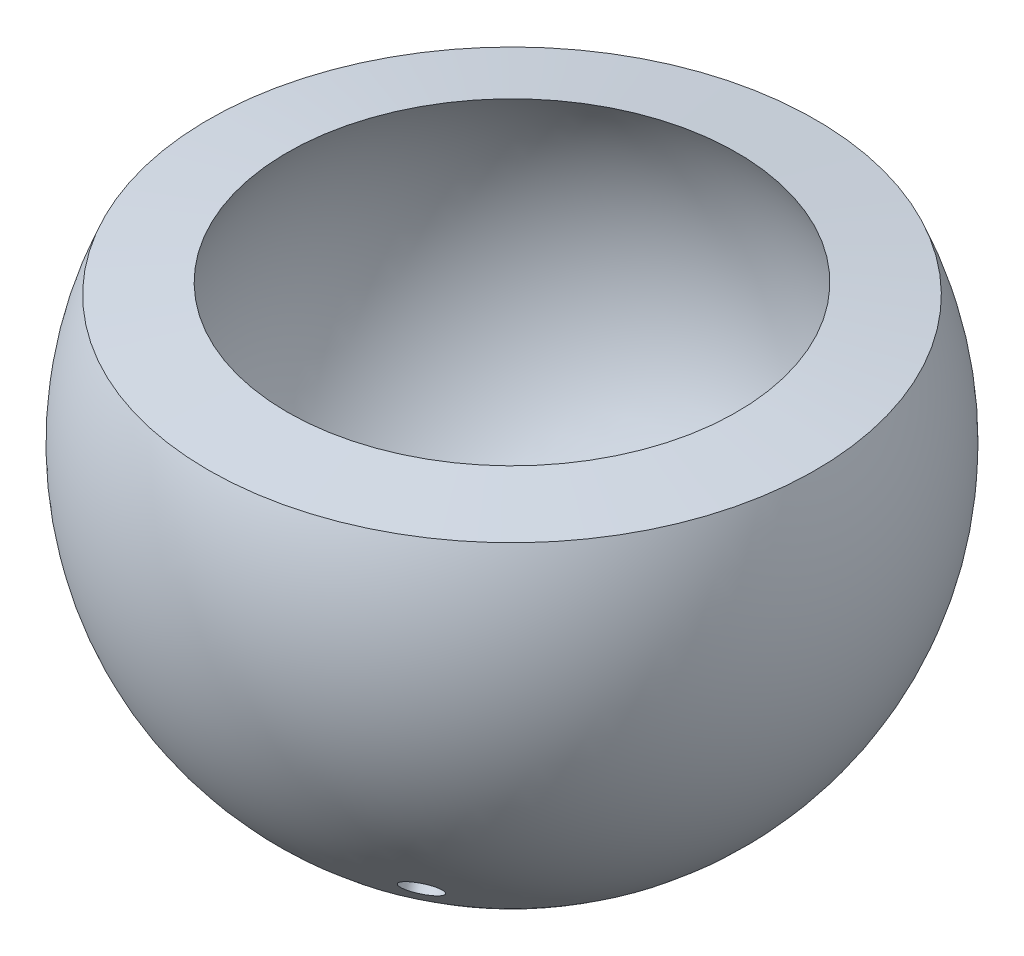
from build123d import *

# Parameters (mm, degrees)
F_7_0_201_DIAMETER_HOLE1_D     = 5.1054
F_7_0_201_DIAMETER_HOLE1_DEPTH = 101.176865362
CIRPATTERN1_COUNT              = 3
SKETCH7_R                      = 2.54
CUT_EXTRUDE1_DEPTH             = 84.368801521


with BuildPart() as part:
    # Sketch1 one side → Revolve1 (revolve)
    with BuildSketch(Plane.XY, mode=Mode.PRIVATE) as revolve1_sk:
        with BuildLine():
            ThreePointArc((0, -38.608), (-33.727527511, -18.789133881), (-32.827964664, 20.32))
            Line((-32.827964664, 20.32), (-44.338235562, 18.7325))
            ThreePointArc((-44.338235562, 18.7325), (-40.115066443, -26.600134083), (0, -48.133))
            Line((0, -48.133), (0, -38.608))
        make_face()
    revolve(revolve1_sk.sketch.rotate(Axis((0, 48.133, 0), (0, -1, 0)), 180), axis=Axis((0, 48.133, 0), (0, -1, 0)))

    # #7 (0.201) Diameter Hole1
    with Locations(Plane(origin=(-36.176279369, -31.75, 0), x_dir=(0.65963060686, -0.751589956355, 0), z_dir=(-0.751589956355, -0.65963060686, 0))):
        with Locations((0, 0)):
            f_7_0_201_diameter_hole1 = Hole(F_7_0_201_DIAMETER_HOLE1_D / 2, depth=F_7_0_201_DIAMETER_HOLE1_DEPTH)

    # CirPattern1: #7 (0.201) Diameter Hole1 ×3 about axis
    cirpattern1_axis = Axis((0, 18.7325, 0), (0, 1, 0))
    for i in range(1, CIRPATTERN1_COUNT):
        add(f_7_0_201_diameter_hole1.rotate(cirpattern1_axis, i * 360 / CIRPATTERN1_COUNT), mode=Mode.SUBTRACT)

    # Sketch7 → Cut-Extrude1 (cut, through all)
    with BuildSketch(Plane(origin=(0, 0, 0), x_dir=(1, 0, 0), z_dir=(0, 1, 0))):
        with Locations(Location((0, 0, 0), (0, 0, 270))):
            Circle(SKETCH7_R)
    extrude(amount=-CUT_EXTRUDE1_DEPTH, mode=Mode.SUBTRACT)


solid = part.part
